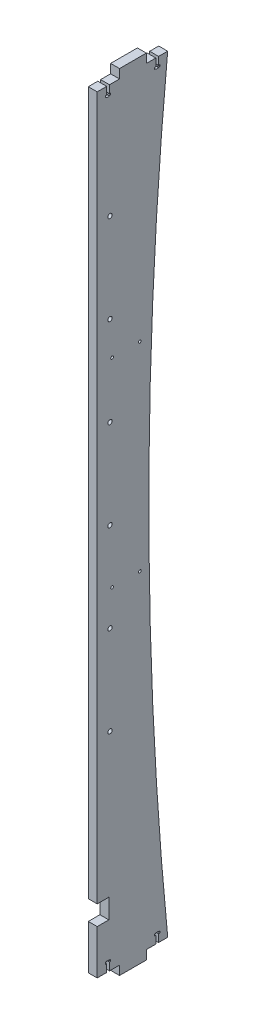
from build123d import *

# Parameters (mm, degrees)
DODANIE_WYCI_GNI_CIE1_DEPTH = 10
SZKIC1_W                    = 30
SZKIC1_H                    = 10.1
SZKIC1_W_2                  = 25
WYTNIJ_WYCI_GNI_CIE1_DEPTH  = 10
WYTNIJ_WYCI_GNI_CIE2_DEPTH  = 10
SZYK_LINIOWY1_COUNT         = 2
SZYK_LINIOWY1_PITCH         = 55
SZKIC7_R                    = 2.45
WYTNIJ_WYCI_GNI_CIE5_DEPTH  = 10
SZYK_LINIOWY3_COUNT         = 6
SZYK_LINIOWY3_PITCH         = 100
SZKIC8_W                    = 13
SZKIC8_H                    = 22
WYTNIJ_WYCI_GNI_CIE6_DEPTH  = 10
LUSTRO1_COPY_1_DEPTH        = 10
SZKIC12_R                   = 1.55
WYTNIJ_WYCI_GNI_CIE7_DEPTH  = 10
SZYK_LINIOWY4_COUNT         = 2
SZYK_LINIOWY4_PITCH         = 223


with BuildPart() as part:
    # Szkic11 → Dodanie-wyciągnięcie1 (new body)
    with BuildSketch(Plane.ZY.offset(-248.52281754)):
        with BuildLine():
            Line((-79.001367167, 0), (0, 0))
            Line((0, 0), (0, 880))
            Line((0, 880), (-78.955177412, 880))
            Line((-78.955177412, 880), (-78.955177412, 870))
            ThreePointArc((-78.955177412, 870), (-57.819766969, 439.998863597), (-79.001367167, 10))
            Line((-79.001367167, 10), (-79.001367167, 0))
        make_face()
    extrude(amount=DODANIE_WYCI_GNI_CIE1_DEPTH)

    # Szkic1 → Wytnij-wyciągnięcie1 (cut)
    with BuildSketch(Plane(origin=(248.52281754, 0, 0), x_dir=(0, 0, -1), z_dir=(1, 0, 0))):
        with Locations((70, 874.95)):
            Rectangle(SZKIC1_W, SZKIC1_H)
        with Locations((12.5, 874.95)):
            Rectangle(SZKIC1_W_2, SZKIC1_H)
    wytnij_wyci_gni_cie1 = extrude(amount=-WYTNIJ_WYCI_GNI_CIE1_DEPTH, mode=Mode.SUBTRACT)

    # Szkic2 → Wytnij-wyciągnięcie2 (cut)
    with BuildSketch(Plane(origin=(248.52281754, 0, 0), x_dir=(0, 0, -1), z_dir=(1, 0, 0))):
        Polygon((10.660920663, 869.9), (13.760920663, 869.9), (13.760920663, 861.4), (15.135920663, 861.4), (15.135920663, 859.4), (13.760920663, 859.4), (13.760920663, 858.9), (10.660920663, 858.9), (10.660920663, 859.4), (9.285920663, 859.4), (9.285920663, 861.4), (10.660920663, 861.4), align=None)
    wytnij_wyci_gni_cie2 = extrude(amount=-WYTNIJ_WYCI_GNI_CIE2_DEPTH, mode=Mode.SUBTRACT)

    # Szyk liniowy1: Wytnij-wyciągnięcie2 ×2
    with Locations(*[(0, 0, -i * SZYK_LINIOWY1_PITCH) for i in range(1, SZYK_LINIOWY1_COUNT)]):
        add(wytnij_wyci_gni_cie2, mode=Mode.SUBTRACT)

    # Szkic7 → Wytnij-wyciągnięcie5 (cut)
    with BuildSketch(Plane(origin=(248.52281754, 0, 0), x_dir=(0, 0, -1), z_dir=(1, 0, 0))):
        with Locations((14.31069395, 742.236985413)):
            Circle(SZKIC7_R)
    wytnij_wyci_gni_cie5 = extrude(amount=-WYTNIJ_WYCI_GNI_CIE5_DEPTH, mode=Mode.SUBTRACT)

    # Szyk liniowy3: Wytnij-wyciągnięcie5 ×6
    with Locations(*[(0, -i * SZYK_LINIOWY3_PITCH, 0) for i in range(1, SZYK_LINIOWY3_COUNT)]):
        add(wytnij_wyci_gni_cie5, mode=Mode.SUBTRACT)

    # Szkic8 → Wytnij-wyciągnięcie6 (cut)
    with BuildSketch(Plane(origin=(248.52281754, 0, 0), x_dir=(0, 0, -1), z_dir=(1, 0, 0))):
        with Locations((6.5, 71)):
            Rectangle(SZKIC8_W, SZKIC8_H)
    extrude(amount=-WYTNIJ_WYCI_GNI_CIE6_DEPTH, mode=Mode.SUBTRACT)

    # Lustro1: Wytnij-wyciągnięcie1, Wytnij-wyciągnięcie2 across plane
    add(wytnij_wyci_gni_cie1.mirror(Plane.ZX.offset(440)), mode=Mode.SUBTRACT)
    add(wytnij_wyci_gni_cie2.mirror(Plane.ZX.offset(440)), mode=Mode.SUBTRACT)

    # Lustro1 copy 1 sketch → Lustro1 copy 1 (cut)
    with BuildSketch(Plane(origin=(248.52281754, 880, -55), x_dir=(0, 0, -1), z_dir=(1, 0, 0))):
        Polygon((10.660920663, -869.9), (13.760920663, -869.9), (13.760920663, -861.4), (15.135920663, -861.4), (15.135920663, -859.4), (13.760920663, -859.4), (13.760920663, -858.9), (10.660920663, -858.9), (10.660920663, -859.4), (9.285920663, -859.4), (9.285920663, -861.4), (10.660920663, -861.4), align=None)
    extrude(amount=-LUSTRO1_COPY_1_DEPTH, mode=Mode.SUBTRACT)

    # Szkic12 → Wytnij-wyciągnięcie7 (cut)
    with BuildSketch(Plane.ZY.offset(-238.52281754)):
        with Locations((-47.7, 380.736985413)):
            Circle(SZKIC12_R)
        with Locations((-16.7, 380.736985413)):
            Circle(SZKIC12_R)
    wytnij_wyci_gni_cie7 = extrude(amount=-WYTNIJ_WYCI_GNI_CIE7_DEPTH, mode=Mode.SUBTRACT)

    # Szyk liniowy4: Wytnij-wyciągnięcie7 ×2
    with Locations(*[(0, i * SZYK_LINIOWY4_PITCH, 0) for i in range(1, SZYK_LINIOWY4_COUNT)]):
        add(wytnij_wyci_gni_cie7, mode=Mode.SUBTRACT)


solid = part.part
